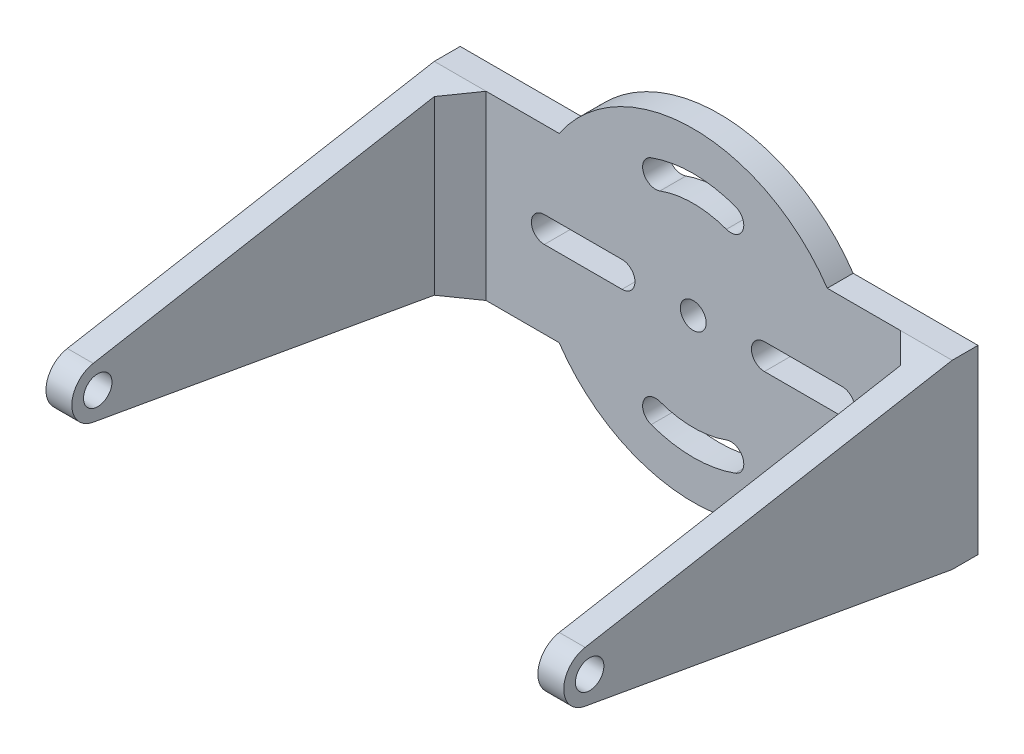
from build123d import *

# Parameters (mm, degrees)
EXTRUDE_1_DEPTH     = 2
EXTRUDE_2_DEPTH     = 2
SKETCH_3_R          = 1
CUT_EXTRUDE_1_DEPTH = 2
CHAMFER_1_SIZE      = 2


with BuildPart() as part:
    # 草图1 → 凸台-拉伸1 (new body)
    with BuildSketch(Plane.XY):
        with BuildLine():
            Line((-20, -7), (-10.356157589, -7))
            ThreePointArc((-10.356157589, -7), (-12.5, 0), (-10.356157589, 7))
            Line((-10.356157589, 7), (-20, 7))
            Line((-20, 7), (-20, -7))
        make_face()
        with BuildLine():
            ThreePointArc((-10.356157589, -7), (-5.8630197, -11.039701083), (0, -12.5))
            Line((0, -12.5), (0, 12.5))
            ThreePointArc((0, 12.5), (-5.8630197, 11.039701083), (-10.356157589, 7))
            ThreePointArc((-10.356157589, 7), (-12.5, 0), (-10.356157589, -7))
        make_face()
        with BuildLine():
            Line((0, 12.5), (0, -12.5))
            ThreePointArc((0, -12.5), (5.8630197, -11.039701083), (10.356157589, -7))
            Line((10.356157589, -7), (10.356157589, 7))
            ThreePointArc((10.356157589, 7), (5.8630197, 11.039701083), (0, 12.5))
        make_face()
        with BuildLine():
            Line((10.356157589, 7), (10.356157589, -7))
            ThreePointArc((10.356157589, -7), (11.952028486, -3.66046651), (12.5, 0))
            ThreePointArc((12.5, 0), (11.952028486, 3.66046651), (10.356157589, 7))
        make_face()
        with BuildLine():
            ThreePointArc((12.5, 0), (11.952028486, -3.66046651), (10.356157589, -7))
            Line((10.356157589, -7), (20, -7))
            Line((20, -7), (20, 7))
            Line((20, 7), (10.356157589, 7))
            ThreePointArc((10.356157589, 7), (11.952028486, 3.66046651), (12.5, 0))
        make_face()
    extrude(amount=EXTRUDE_1_DEPTH)

    # 草图2 → 凸台-拉伸2 (add)
    with BuildSketch(Plane.ZY.offset(20)):
        with BuildLine():
            Line((28.9, 0), (2, 0))
            Line((2, 0), (2, -7))
            Line((2, -7), (30.34945143, -1.969234292))
            ThreePointArc((30.34945143, -1.969234292), (31.532792037, -1.284736771), (32, 0))
            Line((32, 0), (31.1, 0))
            ThreePointArc((31.1, 0), (30, -1.1), (28.9, 0))
        make_face()
        with BuildLine():
            Line((30.34945143, 1.969234292), (2, 7))
            Line((2, 7), (2, 0))
            Line((2, 0), (28.9, 0))
            ThreePointArc((28.9, 0), (30, 1.1), (31.1, 0))
            Line((31.1, 0), (32, 0))
            ThreePointArc((32, 0), (31.532792037, 1.284736771), (30.34945143, 1.969234292))
        make_face()
    extrude_2 = extrude(amount=-EXTRUDE_2_DEPTH)

    # 镜向1: 凸台-拉伸2 across plane
    add(extrude_2.mirror(Plane(origin=(0, 0, 0), x_dir=(0, 0, 1), z_dir=(1, 0, 0))))

    # 草图3 → 切除-拉伸1 (cut)
    with BuildSketch(Plane.XY.offset(2)):
        Circle(SKETCH_3_R)
        with BuildLine():
            Line((-11.5, 1), (-5.5, 1))
            ThreePointArc((-5.5, 1), (-4.5, 0), (-5.5, -1))
            Line((-5.5, -1), (-11.5, -1))
            ThreePointArc((-11.5, -1), (-12.5, 0), (-11.5, 1))
        make_face()
        with BuildLine():
            ThreePointArc((3.249191362, 8.927079897), (0, 9.5), (-3.249191362, 8.927079897))
            ThreePointArc((-3.249191362, 8.927079897), (-3.846863839, 7.645367133), (-2.565151075, 7.047694656))
            ThreePointArc((-2.565151075, 7.047694656), (0, 7.5), (2.565151075, 7.047694656))
            ThreePointArc((2.565151075, 7.047694656), (3.846863839, 7.645367133), (3.249191362, 8.927079897))
        make_face()
    cut_extrude_1 = extrude(amount=-CUT_EXTRUDE_1_DEPTH, mode=Mode.SUBTRACT)

    # 镜向2: 切除-拉伸1 across plane
    add(cut_extrude_1.mirror(Plane.ZX), mode=Mode.SUBTRACT)

    # 镜向3: 切除-拉伸1 across plane
    add(cut_extrude_1.mirror(Plane(origin=(0, 0, 0), x_dir=(0, 0, 1), z_dir=(1, 0, 0))), mode=Mode.SUBTRACT)

    # 倒角1
    chamfer_1_edges = [part.edges().sort_by_distance(p)[0] for p in [
        (-18, 0, 2),
        (18, 0, 2),
    ]]
    chamfer(chamfer_1_edges, length=CHAMFER_1_SIZE)


solid = part.part
